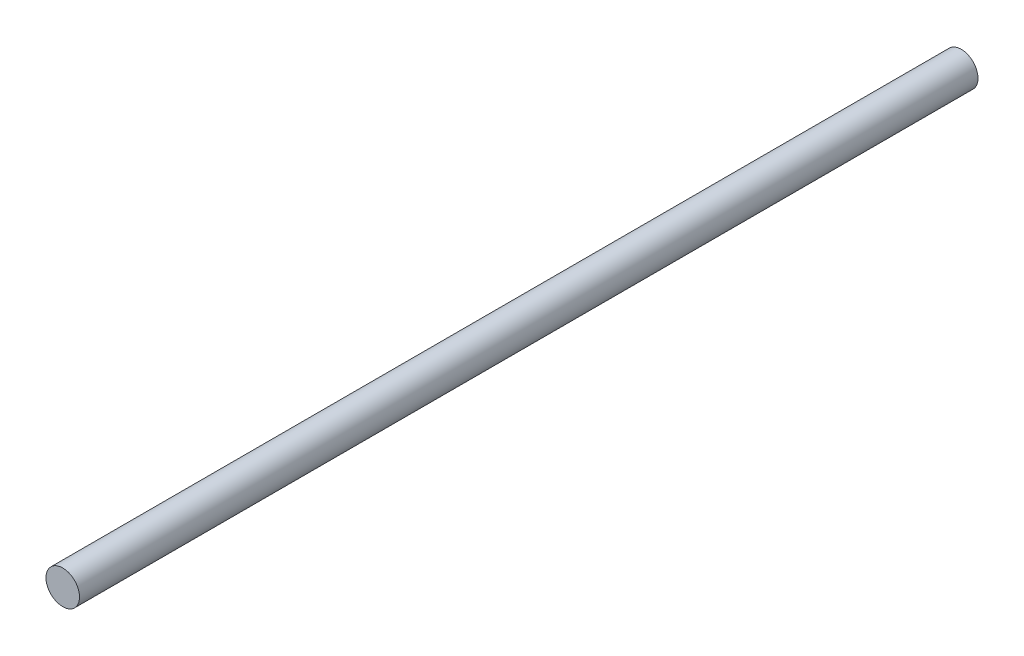
from build123d import *

# Parameters (mm, degrees)
SKETCH1_R           = 0.79375
BOSS_EXTRUDE1_DEPTH = 42.5


with BuildPart() as part:
    # Sketch1 → Boss-Extrude1 (new body)
    with BuildSketch(Plane.XY):
        Circle(SKETCH1_R)
    extrude(amount=BOSS_EXTRUDE1_DEPTH)


solid = part.part
